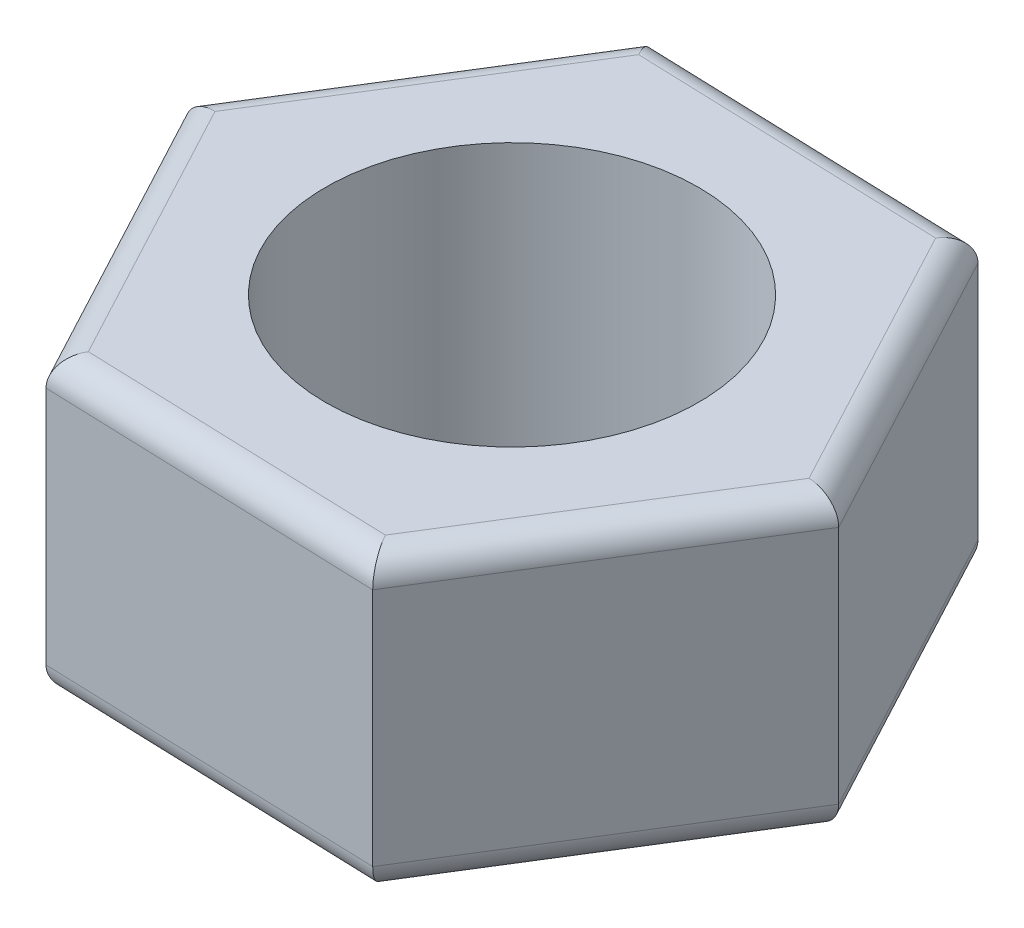
from build123d import *

# Parameters (mm, degrees)
SKETCH1_R           = 7
BOSS_EXTRUDE1_DEPTH = 11
FILLET1_R           = 1


with BuildPart() as part:
    # Sketch1 → Boss-Extrude1 (new body)
    with BuildSketch(Plane(origin=(0, 0, 0), x_dir=(1, 0, 0), z_dir=(0, 1, 0))):
        Polygon((-12.694536404, 0.426706941), (-6.716807253, -10.780437545), (5.977729151, -11.207144486), (12.694536404, -0.426706941), (6.716807253, 10.780437545), (-5.977729151, 11.207144486), align=None)
        with Locations(Location((0, 0, 0), (0, 0, 270))):
            Circle(SKETCH1_R, mode=Mode.SUBTRACT)
    extrude(amount=BOSS_EXTRUDE1_DEPTH)

    # Fillet1
    fillet1_edges = [part.edges().sort_by_distance(p)[0] for p in [
        (-0.369539051, 11, 10.993791015),
        (9.336132778, 11, 5.816925714),
        (9.705671829, 11, -5.176865302),
        (0.369539051, 11, -10.993791015),
        (-9.336132778, 11, -5.816925714),
        (0.369539051, 0, -10.993791015),
        (9.705671829, 0, -5.176865302),
        (9.336132778, 0, 5.816925714),
        (-9.705671829, 11, 5.176865302),
        (-0.369539051, 0, 10.993791015),
        (-9.705671829, 0, 5.176865302),
        (-9.336132778, 0, -5.816925714),
    ]]
    fillet(fillet1_edges, radius=FILLET1_R)


solid = part.part
